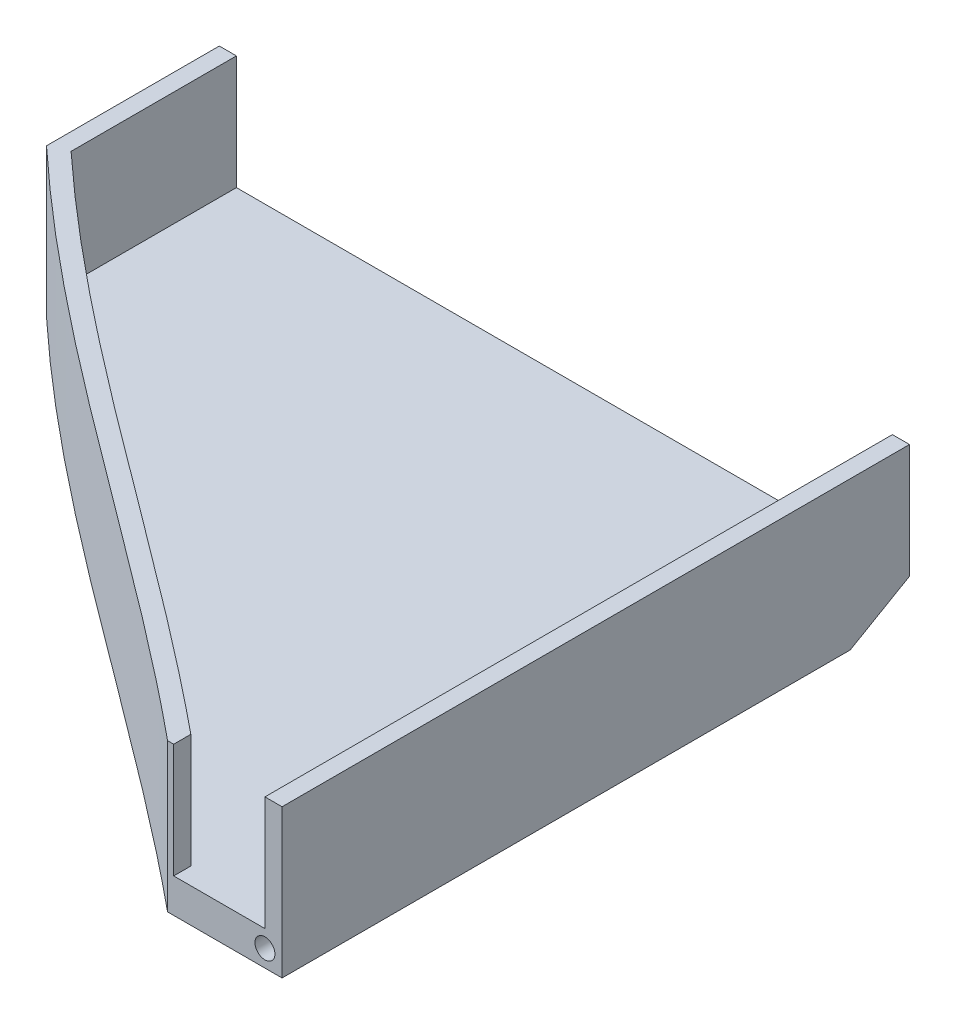
from build123d import *

# Parameters (mm, degrees)
BOSS_EXTRUDE1_DEPTH     = 6
CUT_EXTRUDE1_DEPTH      = 164.636793074
CUT_EXTRUDE1_DEPTH_BACK = 164.636793074
SKETCH2_R               = 1.75
BOSS_EXTRUDE2_DEPTH     = 20
SKETCH4_W               = 132.33663358
SKETCH4_H               = 54.683142632
CUT_EXTRUDE2_DEPTH      = 20


with BuildPart() as part:
    # Sketch1 → Boss-Extrude1 (new body)
    with BuildSketch(Plane(origin=(0, 0, 0), x_dir=(1, 0, 0), z_dir=(0, 1, 0))):
        with BuildLine():
            Line((0, 0), (-121, 0))
            Line((-121, 0), (-121, -30.298554482))
            add(Edge.make_bspline(
                [(-121, -30.298554482), (-89.558533356, -59.655086777), (-53.189409509, -82.739680225), (-20.07, -110)],
                knots=[0, 0, 0, 0, 1, 1, 1, 1], degree=3))
            Line((-20.07, -110), (0, -110))
            Line((0, -110), (0, 0))
        make_face()
    extrude(amount=BOSS_EXTRUDE1_DEPTH)

    # Sketch2 → Cut-Extrude1 (cut, two sides: drawn at the far end of the back side and taken through both)
    with BuildSketch(Plane(origin=(0, 0, 0), x_dir=(-1, 0, 0), z_dir=(0, 0, -1)).offset(-CUT_EXTRUDE1_DEPTH_BACK)):
        with Locations((3, 3)):
            Circle(SKETCH2_R)
    extrude(amount=CUT_EXTRUDE1_DEPTH + CUT_EXTRUDE1_DEPTH_BACK, mode=Mode.SUBTRACT)

    # Sketch3 → Boss-Extrude2 (add)
    with BuildSketch(Plane(origin=(0, 6, 0), x_dir=(1, 0, 0), z_dir=(0, 1, 0))):
        with BuildLine():
            Line((-118, -3), (-118, 0))
            Line((-118, 0), (-121, 0))
            Line((-121, 0), (-121, -30.298554482))
            add(Edge.make_bspline(
                [(-121, -30.298554482), (-89.558533356, -59.655086777), (-53.189409509, -82.739680225), (-20.07, -110)],
                knots=[0, 0, 0, 0, 1, 1, 1, 1], degree=3))
            Line((-20.07, -110), (-18.995872781, -110))
            Line((-18.995872781, -110), (-18.995872781, -107))
            add(Edge.make_bspline(
                [(-118, -28.991909602), (-110.289824181, -36.137206416), (-102.272955066, -42.924098905), (-85.87961507, -56.077650281), (-77.513636875, -62.436539609), (-52.27420649, -81.325206417), (-35.258396574, -93.669770918), (-18.995872781, -107)],
                knots=[0, 0, 0, 0, 0.25, 0.25, 0.5, 0.5, 1, 1, 1, 1], degree=3))
            Line((-118, -28.991909602), (-118, -3))
        make_face()
        Polygon((-3, -3), (-3, 0), (0, 0), (0, -110), (-3, -110), (-3, -107), align=None)
    extrude(amount=BOSS_EXTRUDE2_DEPTH)

    # Sketch4 → Cut-Extrude2 (cut)
    with BuildSketch(Plane(origin=(0, 4.5, 2.598076211), x_dir=(-1, 0, 0), z_dir=(0, -0.8660254037844398, -0.499999999999998))):
        with Locations((60.84284102, -6.354682021)):
            Rectangle(SKETCH4_W, SKETCH4_H)
    extrude(amount=CUT_EXTRUDE2_DEPTH, mode=Mode.SUBTRACT)


solid = part.part
